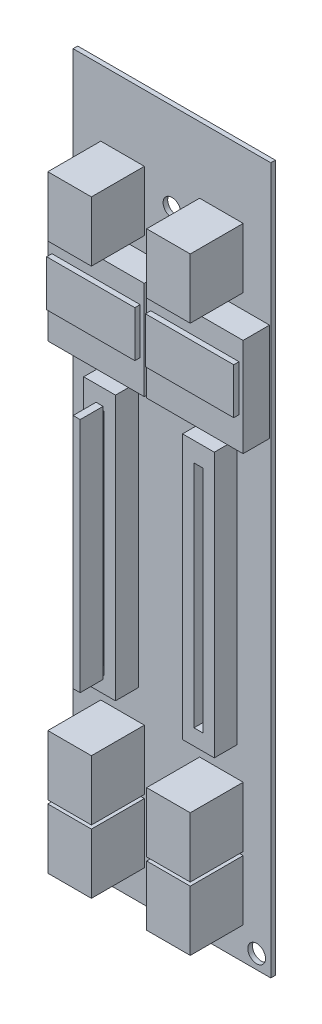
from build123d import *

# Parameters (mm, degrees)
SKETCH1_R                = 2.5
SKETCH1_W                = 12.35
SKETCH1_H                = 17
BOSS_EXTRUDE1_DEPTH      = 1.3
BOSS_EXTRUDE2_DEPTH      = 15
BOSS_EXTRUDE2_DEPTH_BACK = 1.3
SKETCH2_W                = 12.35
SKETCH2_H                = 17
SKETCH3_W                = 27.3
SKETCH3_H                = 27.8
BOSS_EXTRUDE3_DEPTH      = 7.5
SKETCH4_W                = 25
SKETCH4_H                = 13
BOSS_EXTRUDE4_DEPTH      = 1.5
SKETCH5_W                = 9
SKETCH5_H                = 75
SKETCH5_W_2              = 2.5
SKETCH5_H_2              = 65
BOSS_EXTRUDE5_DEPTH      = 6.5
SKETCH7_W                = 1
SKETCH7_H                = 1
SKETCH7_H_2              = 65
BOSS_EXTRUDE6_DEPTH      = 6.5


with BuildPart() as part:
    # Sketch1 → Boss-Extrude1 (new body)
    with BuildSketch(Plane.XY):
        Polygon((0, 200), (0, 0), (3.731641176, 0), (10.2, 0), (28, 0), (38.2, 0), (56, 0), (56, 200), align=None)
        with Locations((4, 4)):
            Circle(SKETCH1_R, mode=Mode.SUBTRACT)
        Polygon((20.185, 9.125), (10.2, 9.125), (7.835, 9.125), (7.835, 26.125), (20.185, 26.125), align=None, mode=Mode.SUBTRACT)
        with Locations((14.01, 35.625)):
            Rectangle(SKETCH1_W, SKETCH1_H, mode=Mode.SUBTRACT)
        Polygon((48.185, 9.125), (38.2, 9.125), (35.835, 9.125), (35.835, 26.125), (48.185, 26.125), align=None, mode=Mode.SUBTRACT)
        with Locations((52, 4)):
            Circle(SKETCH1_R, mode=Mode.SUBTRACT)
        with Locations((42.01, 35.625)):
            Rectangle(SKETCH1_W, SKETCH1_H, mode=Mode.SUBTRACT)
        Polygon((20.185, 164.225), (10.2, 164.225), (7.835, 164.225), (7.835, 181.225), (20.185, 181.225), align=None, mode=Mode.SUBTRACT)
        with BuildLine():
            ThreePointArc((30.5, 175), (29.767766953, 173.232233047), (28, 172.5))
            ThreePointArc((28, 172.5), (26.232233047, 176.767766953), (30.5, 175))
        make_face(mode=Mode.SUBTRACT)
        Polygon((48.185, 164.225), (38.2, 164.225), (35.835, 164.225), (35.835, 181.225), (48.185, 181.225), align=None, mode=Mode.SUBTRACT)
    extrude(amount=BOSS_EXTRUDE1_DEPTH)

    # Sketch2 → Boss-Extrude2 (add, two sides: drawn at the far end of the back side and taken through both)
    with BuildSketch(Plane.XY.offset(1.3).offset(-BOSS_EXTRUDE2_DEPTH_BACK)):
        with Locations((14.01, 172.725)):
            Rectangle(SKETCH2_W, SKETCH2_H)
        with Locations((42.01, 172.725)):
            Rectangle(SKETCH2_W, SKETCH2_H)
        with Locations((42.01, 35.625)):
            Rectangle(SKETCH2_W, SKETCH2_H)
        with Locations((42.01, 17.625)):
            Rectangle(SKETCH2_W, SKETCH2_H)
        with Locations((14.01, 17.625)):
            Rectangle(SKETCH2_W, SKETCH2_H)
        with Locations((14.01, 35.625)):
            Rectangle(SKETCH2_W, SKETCH2_H)
    extrude(amount=BOSS_EXTRUDE2_DEPTH + BOSS_EXTRUDE2_DEPTH_BACK)

    # Sketch3 → Boss-Extrude3 (add)
    with BuildSketch(Plane.XY.offset(1.3)):
        with Locations((14, 146.1)):
            Rectangle(SKETCH3_W, SKETCH3_H)
        with Locations((42, 146.1)):
            Rectangle(SKETCH3_W, SKETCH3_H)
    extrude(amount=BOSS_EXTRUDE3_DEPTH)

    # Sketch4 → Boss-Extrude4 (add)
    with BuildSketch(Plane.XY.offset(8.8)):
        with Locations((14, 147.7)):
            Rectangle(SKETCH4_W, SKETCH4_H)
        with Locations((42, 147.7)):
            Rectangle(SKETCH4_W, SKETCH4_H)
    extrude(amount=BOSS_EXTRUDE4_DEPTH)

    # Sketch5 → Boss-Extrude5 (add)
    # profile 1 of 2: a face of its own
    with BuildSketch(Plane.XY.offset(1.3)):
        with Locations((14, 90)):
            Rectangle(SKETCH5_W, SKETCH5_H)
        with Locations((14, 89.5)):
            Rectangle(SKETCH5_W_2, SKETCH5_H_2, mode=Mode.SUBTRACT)
    # profile 2 of 2: a face of its own
    with BuildSketch(Plane.XY.offset(1.3)):
        with Locations((42, 90)):
            Rectangle(SKETCH5_W, SKETCH5_H)
        with Locations((42, 89.5)):
            Rectangle(SKETCH5_W_2, SKETCH5_H_2, mode=Mode.SUBTRACT)
    extrude(amount=BOSS_EXTRUDE5_DEPTH)

    # Sketch7 → Boss-Extrude6 (add)
    with BuildSketch(Plane.XY.offset(7.8)):
        with Locations((13.5, 122.5)):
            Rectangle(SKETCH7_W, SKETCH7_H)
        with Locations((14.5, 122.5)):
            Rectangle(SKETCH7_W, SKETCH7_H)
        with Locations((13.5, 89.5)):
            Rectangle(SKETCH7_W, SKETCH7_H_2)
        with Locations((14.5, 89.5)):
            Rectangle(SKETCH7_W, SKETCH7_H_2)
        with Locations((14.5, 56.5)):
            Rectangle(SKETCH7_W, SKETCH7_H)
        with Locations((13.5, 56.5)):
            Rectangle(SKETCH7_W, SKETCH7_H)
    extrude(amount=BOSS_EXTRUDE6_DEPTH)


solid = part.part
